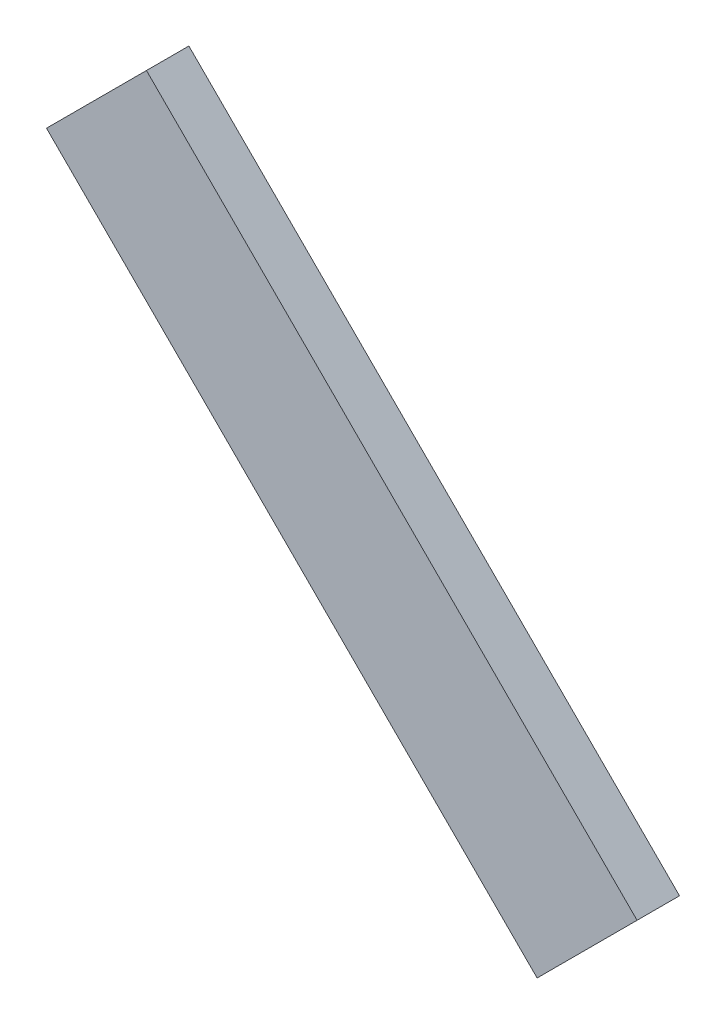
from build123d import *

# Parameters (mm, degrees)
EXTRUDE_1_DEPTH = 3


with BuildPart() as part:
    # 草圖1 → 填料-伸長1 (new body)
    with BuildSketch(Plane.XY):
        Polygon((105.922845502, 85.346212256), (140.627646323, 50.641411436), (133.556578511, 43.570343624), (98.851777691, 78.275144444), align=None)
    extrude(amount=EXTRUDE_1_DEPTH)


solid = part.part
